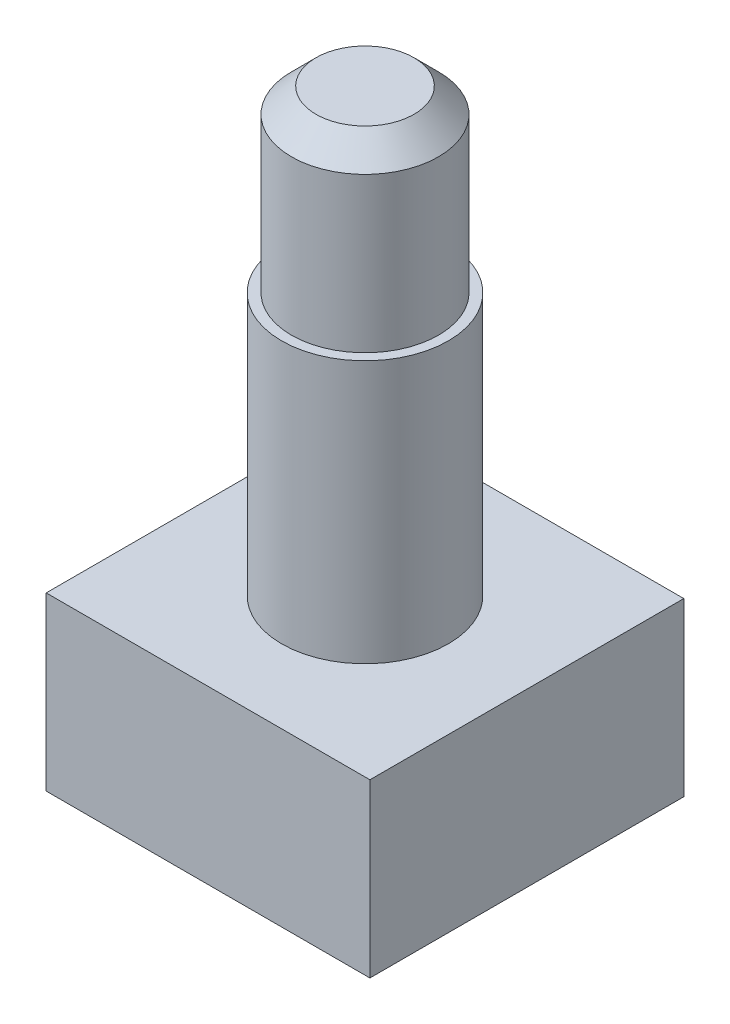
from build123d import *

# Parameters (mm, degrees)
SKETCH1_W           = 13.2
SKETCH1_H           = 12.8
BOSS_EXTRUDE1_DEPTH = 7
SKETCH2_R           = 3.4
BOSS_EXTRUDE2_DEPTH = 18
CUT_EXTRUDE1_START  = -7.3
SKETCH3_R           = 3.4
SKETCH3_R_2         = 3
CUT_EXTRUDE1_DEPTH  = 7.3


with BuildPart() as part:
    # Sketch1 → Boss-Extrude1 (new body)
    with BuildSketch(Plane(origin=(0, 0, 0), x_dir=(1, 0, 0), z_dir=(0, 1, 0))):
        with Locations((6.6, 6.4)):
            Rectangle(SKETCH1_W, SKETCH1_H)
    extrude(amount=BOSS_EXTRUDE1_DEPTH)

    # Sketch2 → Boss-Extrude2 (add)
    with BuildSketch(Plane(origin=(0, 7, 0), x_dir=(1, 0, 0), z_dir=(0, 1, 0))):
        with Locations((6.6, 6.4)):
            Circle(SKETCH2_R)
    extrude(amount=BOSS_EXTRUDE2_DEPTH)

    # Sketch3 → Cut-Extrude1 (cut)
    with BuildSketch(Plane(origin=(0, 25, 0), x_dir=(1, 0, 0), z_dir=(0, 1, 0)).offset(CUT_EXTRUDE1_START)):
        with Locations((6.6, 6.4)):
            Circle(SKETCH3_R)
        with Locations((6.6, 6.4)):
            Circle(SKETCH3_R_2, mode=Mode.SUBTRACT)
    extrude(amount=CUT_EXTRUDE1_DEPTH, mode=Mode.SUBTRACT)

    # Sketch7 → Cut-Revolve2 (revolve, cut)
    with BuildSketch(Plane.XY.offset(-6.4)):
        Polygon((8.6, 25), (9.6, 24), (9.6, 25), align=None)
    revolve(axis=Axis((6.6, 25, -6.4), (0, 1, 0)), mode=Mode.SUBTRACT)


solid = part.part
